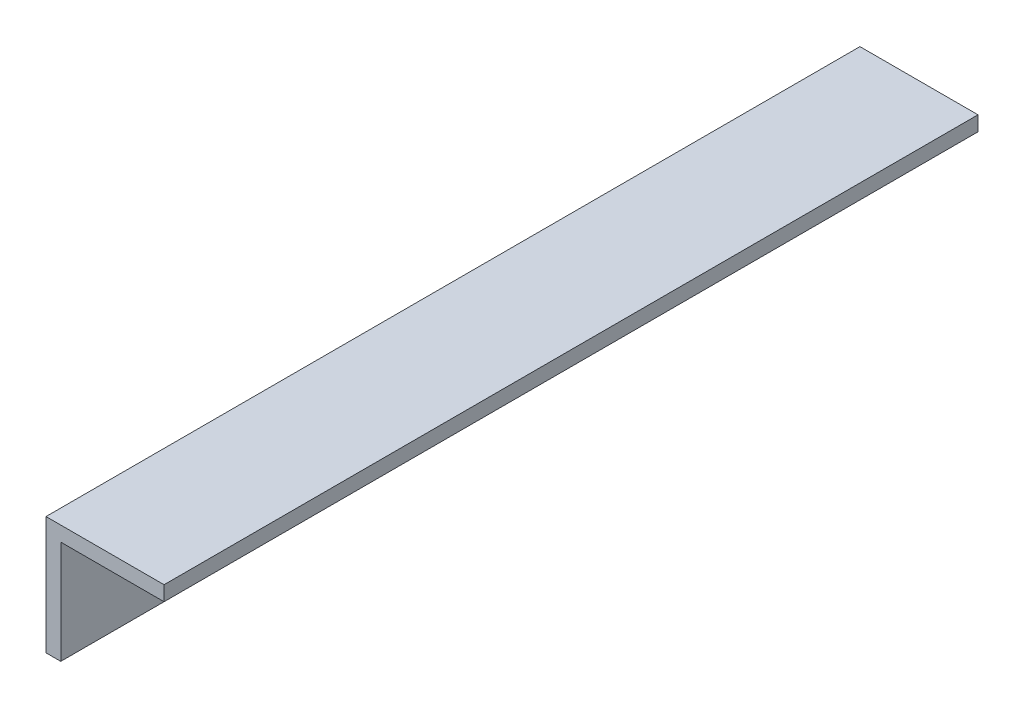
from build123d import *

# Parameters (mm, degrees)
BOSS_EXTRUDE1_DEPTH = 175.1


with BuildPart() as part:
    # Sketch1 → Boss-Extrude1 (new body)
    with BuildSketch(Plane.XY):
        Polygon((0, 0), (0, 25.4), (25.4, 25.4), (25.4, 22.225), (3.175, 22.225), (3.175, 0), align=None)
    extrude(amount=BOSS_EXTRUDE1_DEPTH)


solid = part.part
